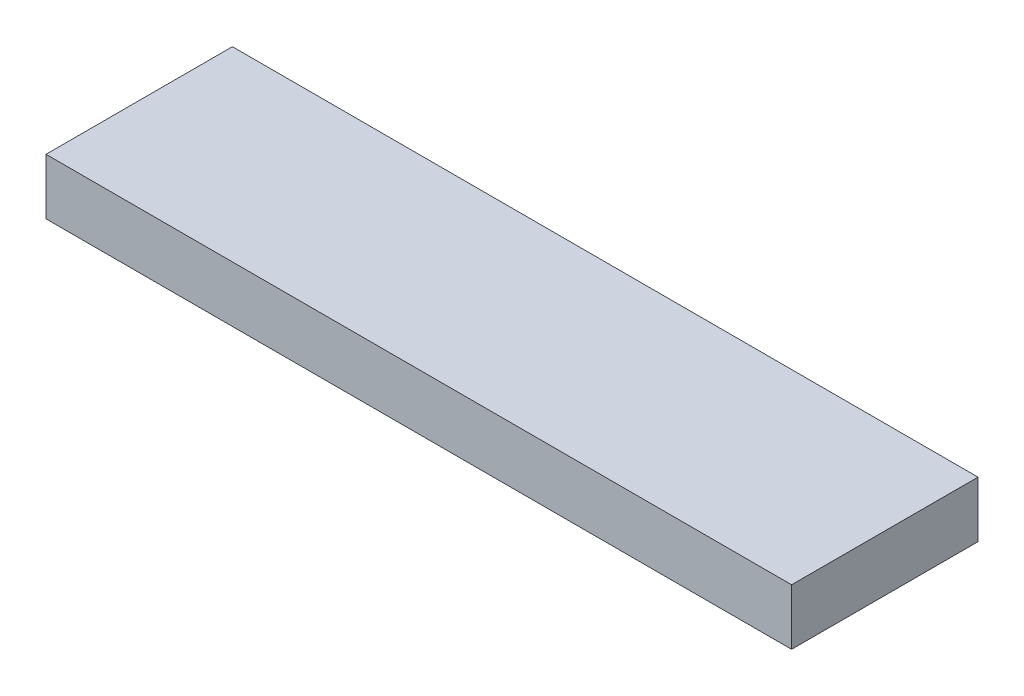
from build123d import *

# Parameters (mm, degrees)
SKETCH1_W           = 200
SKETCH1_H           = 50
BOSS_EXTRUDE1_DEPTH = 7.5


with BuildPart() as part:
    # Sketch1 → Boss-Extrude1 (new, symmetric)
    with BuildSketch(Plane(origin=(0, 0, 0), x_dir=(1, 0, 0), z_dir=(0, 1, 0))):
        Rectangle(SKETCH1_W, SKETCH1_H)
    extrude(amount=BOSS_EXTRUDE1_DEPTH, both=True)


solid = part.part
